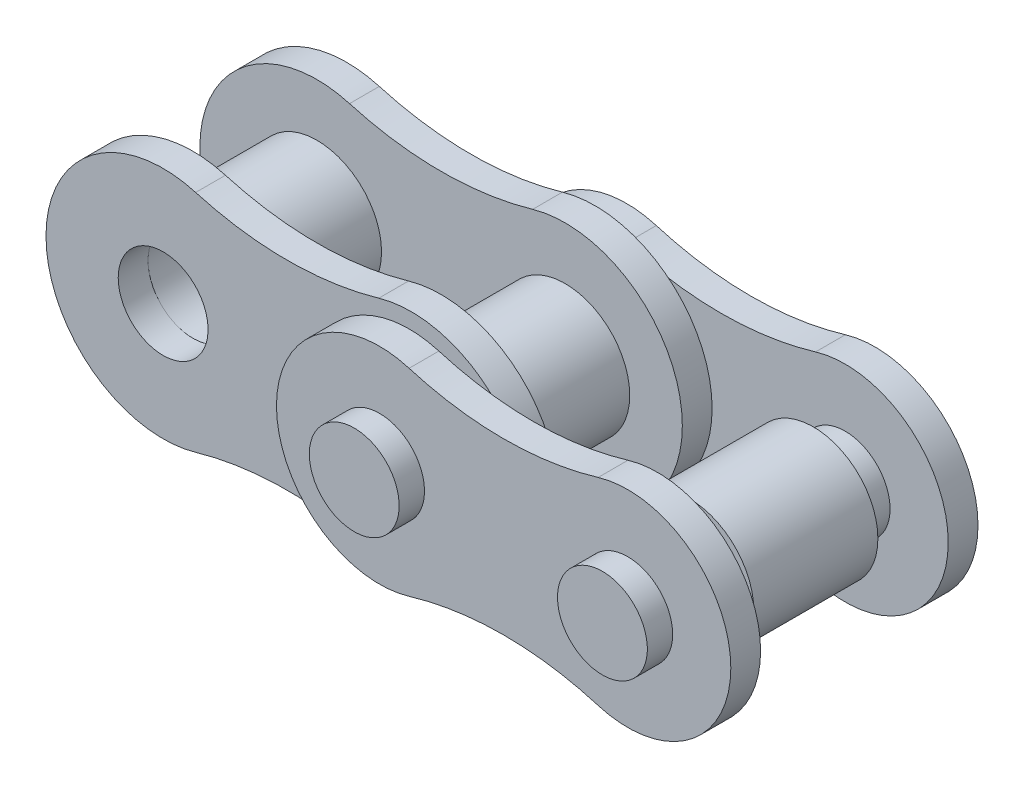
from build123d import *

# Parameters (mm, degrees)
SKETCH4_R                  = 1.651
SKETCH4_R_2                = 1.17475
BOSS_EXTRUDE1_DEPTH        = 1.5875
BOSS_EXTRUDE1_2_DEPTH      = 1.5875
SKETCH5_R                  = 1.14935
BOSS_EXTRUDE2_DEPTH        = 0.762
LPATTERN1_COUNT            = 2
LPATTERN1_PITCH            = 6.35
SKETCH7_R                  = 1.14935
BOSS_EXTRUDE3_DEPTH        = 0.762
BOSS_EXTRUDE4_DEPTH        = 3.81
BOSS_EXTRUDE4_DEPTH_BACK   = 3.81
SKETCH8_R                  = 1.14935
BOSS_EXTRUDE4_2_DEPTH      = 3.81
BOSS_EXTRUDE4_2_DEPTH_BACK = 3.81


with BuildPart() as part:
    # Sketch4 → Boss-Extrude1 (new, symmetric)
    with BuildSketch(Plane.XY):
        with Locations((-3.175, 0)):
            Circle(SKETCH4_R)
        with Locations((-3.175, 0)):
            Circle(SKETCH4_R_2, mode=Mode.SUBTRACT)
    extrude(amount=BOSS_EXTRUDE1_DEPTH, both=True)


with BuildPart() as body_2:
    # Sketch4 → Boss-Extrude1 2 (new, symmetric)
    with BuildSketch(Plane.XY):
        with Locations((3.175, 0)):
            Circle(SKETCH4_R)
        with Locations((3.175, 0)):
            Circle(SKETCH4_R_2, mode=Mode.SUBTRACT)
    extrude(amount=BOSS_EXTRUDE1_2_DEPTH, both=True)


with BuildPart() as body_3:
    # Sketch5 → Boss-Extrude2 (new body)
    with BuildSketch(Plane.XY.offset(1.5875)):
        with BuildLine():
            ThreePointArc((-2.342877482, 2.879371452), (-6.1722, 0), (-2.342877482, -2.879371452))
            ThreePointArc((-2.342877482, -2.879371452), (0, -2.54762), (2.342877482, -2.879371452))
            ThreePointArc((2.342877482, -2.879371452), (6.1722, 0), (2.342877482, 2.879371452))
            ThreePointArc((2.342877482, 2.879371452), (0, 2.54762), (-2.342877482, 2.879371452))
        make_face()
        with Locations(Location((-3.175, 0, 0), (0, 0, 180))):
            Circle(SKETCH5_R, mode=Mode.SUBTRACT)
        with Locations(Location((3.175, 0, 0), (0, 0, 180))):
            Circle(SKETCH5_R, mode=Mode.SUBTRACT)
    extrude(amount=BOSS_EXTRUDE2_DEPTH)


with BuildPart() as lpattern1_1:
    # LPattern1: pattern copy
    add(body_2.part.moved(Location(Vector(1, 0, 0) * (1 * LPATTERN1_PITCH))))


with BuildPart() as body_5:
    # Sketch7 → Boss-Extrude3 (new body)
    with BuildSketch(Plane.XY.offset(-2.4003)):
        with BuildLine():
            ThreePointArc((3.931045679, 2.526853989), (0.537464, 0), (3.931045679, -2.526853989))
            ThreePointArc((3.931045679, -2.526853989), (6.35, -2.17272892), (8.768954321, -2.526853989))
            ThreePointArc((8.768954321, -2.526853989), (12.162536, 0), (8.768954321, 2.526853989))
            ThreePointArc((8.768954321, 2.526853989), (6.35, 2.17272892), (3.931045679, 2.526853989))
        make_face()
        with Locations((3.175, 0)):
            Circle(SKETCH7_R, mode=Mode.SUBTRACT)
        with Locations((9.525, 0)):
            Circle(SKETCH7_R, mode=Mode.SUBTRACT)
    extrude(amount=-BOSS_EXTRUDE3_DEPTH)


with BuildPart() as body_6:
    # Mirror1: mirrored copy
    add(body_3.part.mirror(Plane.XY))


with BuildPart() as body_7:
    # Mirror1 2: mirrored copy
    add(body_5.part.mirror(Plane.XY))


with BuildPart() as body_8:
    # Sketch8 → Boss-Extrude4 (new, two sides: drawn at the far end of the back side and taken through both)
    with BuildSketch(Plane.XY.offset(-BOSS_EXTRUDE4_DEPTH_BACK)):
        with Locations(Location((3.175, 0, 0), (0, 0, 180))):
            Circle(SKETCH8_R)
    extrude(amount=BOSS_EXTRUDE4_DEPTH + BOSS_EXTRUDE4_DEPTH_BACK)


with BuildPart() as body_9:
    # Sketch8 → Boss-Extrude4 2 (new, two sides: drawn at the far end of the back side and taken through both)
    with BuildSketch(Plane.XY.offset(-BOSS_EXTRUDE4_2_DEPTH_BACK)):
        with Locations(Location((9.525, 0, 0), (0, 0, 180))):
            Circle(SKETCH8_R)
    extrude(amount=BOSS_EXTRUDE4_2_DEPTH + BOSS_EXTRUDE4_2_DEPTH_BACK)


solid = Compound([part.part, body_2.part, body_3.part, lpattern1_1.part, body_5.part, body_6.part, body_7.part, body_8.part, body_9.part])
